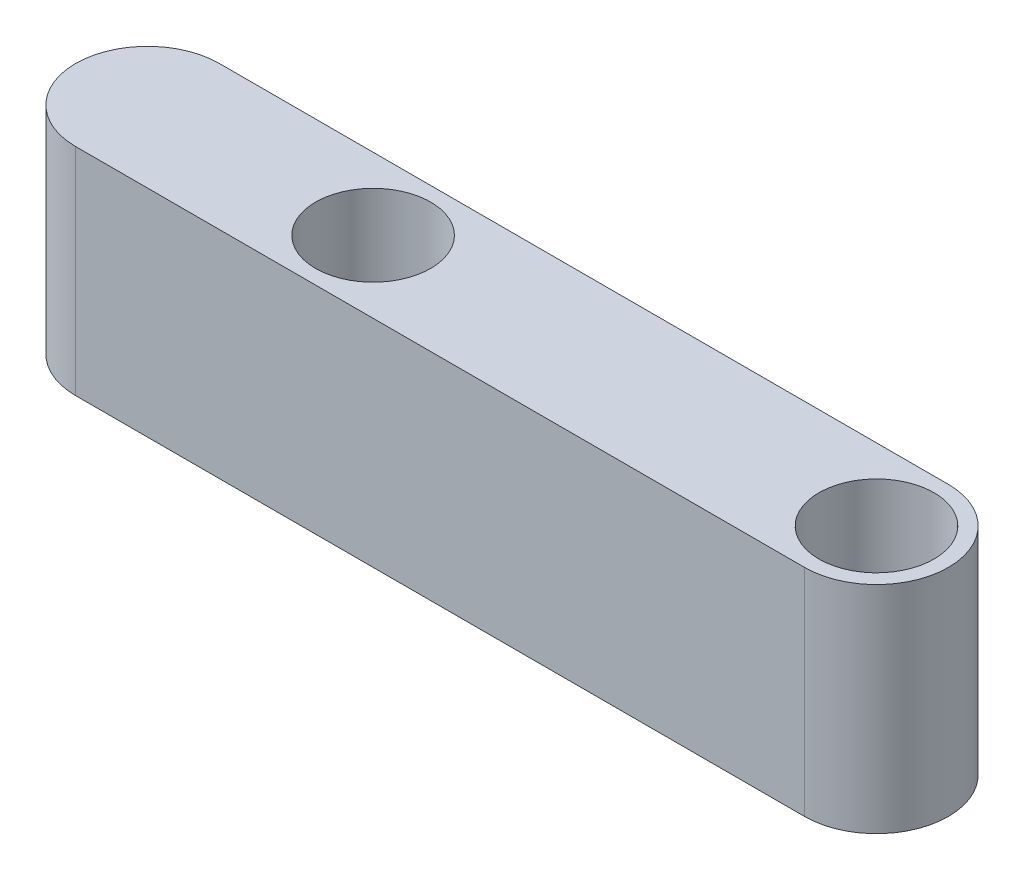
from build123d import *

# Parameters (mm, degrees)
SKETCH1_R           = 0.4
BOSS_EXTRUDE1_DEPTH = 1.5


with BuildPart() as part:
    # Sketch1 → Boss-Extrude1 (new body)
    with BuildSketch(Plane(origin=(0, 0, 0), x_dir=(1, 0, 0), z_dir=(0, 1, 0))):
        with BuildLine():
            Line((-43.461642965, 32.7620803), (-48.53032857, 32.7620803))
            ThreePointArc((-48.53032857, 32.7620803), (-49.03032857, 32.2620803), (-48.53032857, 31.7620803))
            Line((-48.53032857, 31.7620803), (-43.461642965, 31.7620803))
            ThreePointArc((-43.461642965, 31.7620803), (-42.961642965, 32.2620803), (-43.461642965, 32.7620803))
        make_face()
        with BuildLine():
            ThreePointArc((-46.561642965, 32.2620803), (-46.961642965, 31.8620803), (-47.361642965, 32.2620803))
            ThreePointArc((-47.361642965, 32.2620803), (-46.961642965, 32.6620803), (-46.561642965, 32.2620803))
        make_face(mode=Mode.SUBTRACT)
        with Locations(Location((-43.461642965, 32.2620803, 0), (0, 0, 270))):
            Circle(SKETCH1_R, mode=Mode.SUBTRACT)
    extrude(amount=BOSS_EXTRUDE1_DEPTH)


solid = part.part
